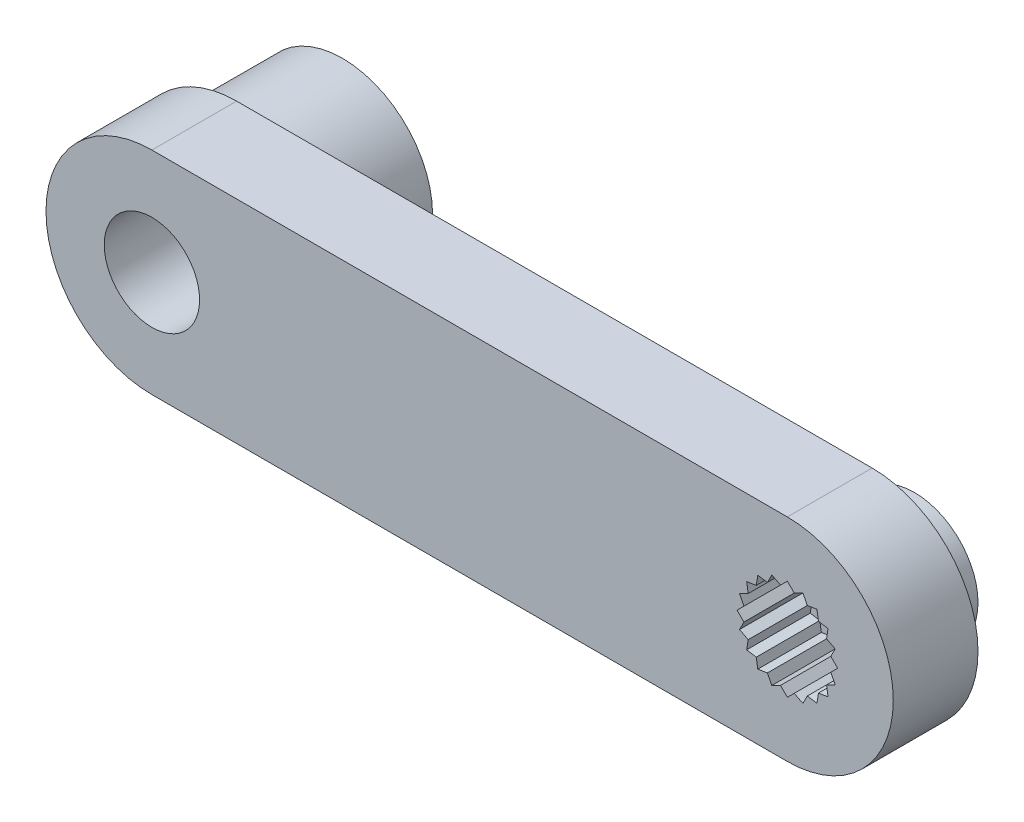
from build123d import *
from build123d.topology import SkipClean

# Parameters (mm, degrees)
SKETCH1_R           = 2.25
SKETCH1_R_2         = 1
BOSS_EXTRUDE1_DEPTH = 2
BOSS_EXTRUDE2_START = 2
SKETCH3_R           = 3
SKETCH3_R_2         = 1
BOSS_EXTRUDE2_DEPTH = 2
BOSS_EXTRUDE3_START = 5
SKETCH4_R           = 4.25
SKETCH4_R_2         = 2.25
BOSS_EXTRUDE3_DEPTH = 5
CUT_EXTRUDE1_DEPTH  = 3


with BuildPart() as part:
    # Sketch1 → Boss-Extrude1 (new, symmetric)
    with BuildSketch(Plane.XY):
        with BuildLine():
            Line((0, 5), (30, 5))
            ThreePointArc((30, 5), (35, 0), (30, -5))
            Line((30, -5), (0, -5))
            ThreePointArc((0, -5), (-5, 0), (0, 5))
        make_face()
        Circle(SKETCH1_R, mode=Mode.SUBTRACT)
        with Locations((30, 0)):
            Circle(SKETCH1_R_2, mode=Mode.SUBTRACT)
    extrude(amount=BOSS_EXTRUDE1_DEPTH, both=True)

    # Sketch3 → Boss-Extrude2 (add)
    with SkipClean():  # the faces are left unmerged after this step: merging them gives an invalid solid
        with BuildSketch(Plane(origin=(0, 0, -2), x_dir=(-1, 0, 0), z_dir=(0, 0, -1)).offset(BOSS_EXTRUDE2_START)):
            with Locations(Location((-30, 0, 0), (0, 0, 180))):
                Circle(SKETCH3_R)
            with Locations((-30, 0)):
                Circle(SKETCH3_R_2, mode=Mode.SUBTRACT)
        extrude(amount=-BOSS_EXTRUDE2_DEPTH)

    # Sketch4 → Boss-Extrude3 (add)
    with SkipClean():  # the faces are left unmerged after this step: merging them gives an invalid solid
        with BuildSketch(Plane(origin=(0, 0, -2), x_dir=(-1, 0, 0), z_dir=(0, 0, -1)).offset(BOSS_EXTRUDE3_START)):
            with Locations(Location((0, 0, 0), (0, 0, 180))):
                Circle(SKETCH4_R)
            Circle(SKETCH4_R_2, mode=Mode.SUBTRACT)
        extrude(amount=-BOSS_EXTRUDE3_DEPTH)

    # Sketch6 → Cut-Extrude1 (cut)
    with SkipClean():  # the faces are left unmerged after this step: merging them gives an invalid solid
        with BuildSketch(Plane.XY.offset(2)):
            Polygon((29.675269252, 2.050269252), (30, 2.375), (30.324730748, 2.050269252), (30.733915362, 2.258759226), (30.942405336, 1.849574613), (31.395989974, 1.921415362), (31.467830723, 1.467830723), (31.921415362, 1.395989974), (31.849574613, 0.942405336), (32.258759226, 0.733915362), (32.050269252, 0.324730748), (32.375, 0), (32.050269252, -0.324730748), (32.258759226, -0.733915362), (31.849574613, -0.942405336), (31.921415362, -1.395989974), (31.467830723, -1.467830723), (31.395989974, -1.921415362), (30.942405336, -1.849574613), (30.733915362, -2.258759226), (30.324730748, -2.050269252), (30, -2.375), (29.675269252, -2.050269252), (29.266084638, -2.258759226), (29.057594664, -1.849574613), (28.604010026, -1.921415362), (28.532169277, -1.467830723), (28.078584638, -1.395989974), (28.150425387, -0.942405336), (27.741240774, -0.733915362), (27.949730748, -0.324730748), (27.625, 0), (27.949730748, 0.324730748), (27.741240774, 0.733915362), (28.150425387, 0.942405336), (28.078584638, 1.395989974), (28.532169277, 1.467830723), (28.604010026, 1.921415362), (29.057594664, 1.849574613), (29.266084638, 2.258759226), align=None)
        extrude(amount=-CUT_EXTRUDE1_DEPTH, mode=Mode.SUBTRACT)


solid = part.part
